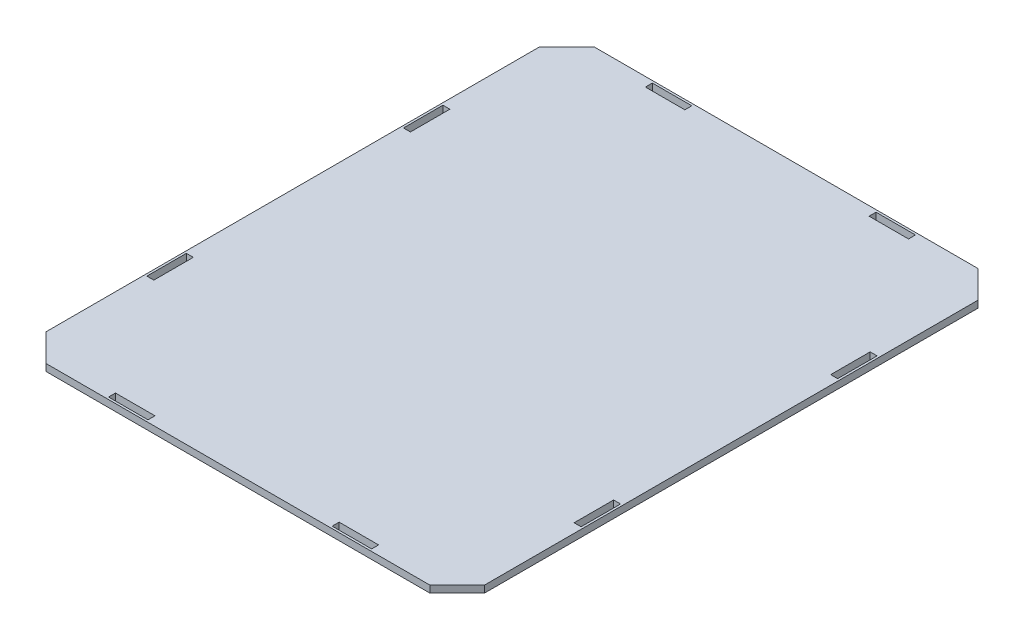
from build123d import *

# Parameters (mm, degrees)
SKETCH2_W           = 400
SKETCH2_H           = 500
BOSS_EXTRUDE2_DEPTH = 6.35
CHAMFER1_SIZE       = 25
SKETCH9_W           = 6.35
SKETCH9_H           = 36
SKETCH9_W_2         = 36
SKETCH9_H_2         = 6.35
CUT_EXTRUDE1_DEPTH  = 321.219178845


with BuildPart() as part:
    # Sketch2 → Boss-Extrude2 (new body)
    with BuildSketch(Plane(origin=(0, 0, 0), x_dir=(1, 0, 0), z_dir=(0, 1, 0))):
        Rectangle(SKETCH2_W, SKETCH2_H)
    extrude(amount=BOSS_EXTRUDE2_DEPTH)

    # Chamfer1
    chamfer1_edges = [part.edges().sort_by_distance(p)[0] for p in [
        (200, 3.175, 250),
        (-200, 3.175, 250),
        (-200, 3.175, -250),
        (200, 3.175, -250),
    ]]
    chamfer(chamfer1_edges, length=CHAMFER1_SIZE)

    # Sketch9 → Cut-Extrude1 (cut, through all)
    with BuildSketch(Plane(origin=(0, 6.35, 0), x_dir=(1, 0, 0), z_dir=(0, 1, 0))):
        with Locations((194.825, 117)):
            Rectangle(SKETCH9_W, SKETCH9_H)
        with Locations((102, -244.825)):
            Rectangle(SKETCH9_W_2, SKETCH9_H_2)
        with Locations((-102, -244.825)):
            Rectangle(SKETCH9_W_2, SKETCH9_H_2)
        with Locations((-102, 244.825)):
            Rectangle(SKETCH9_W_2, SKETCH9_H_2)
        with Locations((102, 244.825)):
            Rectangle(SKETCH9_W_2, SKETCH9_H_2)
        with Locations((194.825, -117)):
            Rectangle(SKETCH9_W, SKETCH9_H)
        with Locations((-194.825, -117)):
            Rectangle(SKETCH9_W, SKETCH9_H)
        with Locations((-194.825, 117)):
            Rectangle(SKETCH9_W, SKETCH9_H)
    extrude(amount=-CUT_EXTRUDE1_DEPTH, mode=Mode.SUBTRACT)


solid = part.part
